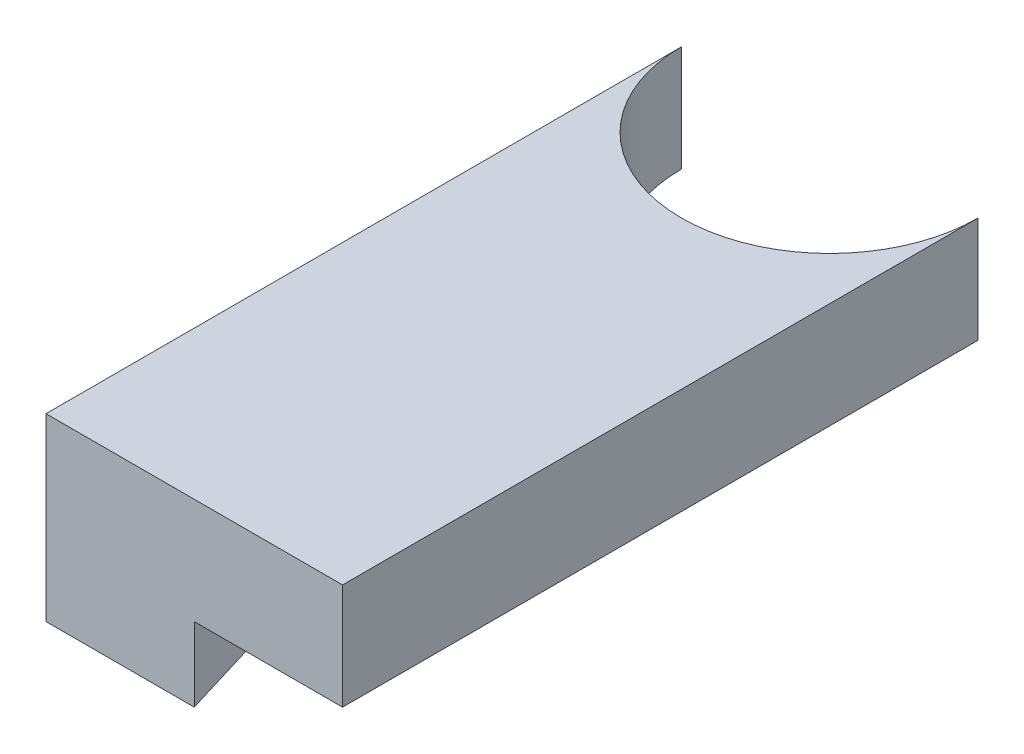
from build123d import *

# Parameters (mm, degrees)
BOSS_EXTRUDE1_DEPTH = 2.54
BOSS_EXTRUDE2_DEPTH = 1.778


with BuildPart() as part:
    # Sketch1 → Boss-Extrude1 (new body)
    with BuildSketch(Plane(origin=(0, 0, 0), x_dir=(1, 0, 0), z_dir=(0, 1, 0))):
        with BuildLine():
            Line((0, 15.24), (0, 0))
            Line((0, 0), (7.112, 0))
            Line((7.112, 0), (7.112, 15.24))
            ThreePointArc((7.112, 15.24), (3.556, 11.684), (0, 15.24))
        make_face()
    extrude(amount=BOSS_EXTRUDE1_DEPTH)

    # Sketch2 → Boss-Extrude2 (add)
    with BuildSketch(Plane.XZ):
        Polygon((0, 0), (3.556, 0), (0, -11.684), align=None)
    extrude(amount=BOSS_EXTRUDE2_DEPTH)


solid = part.part
